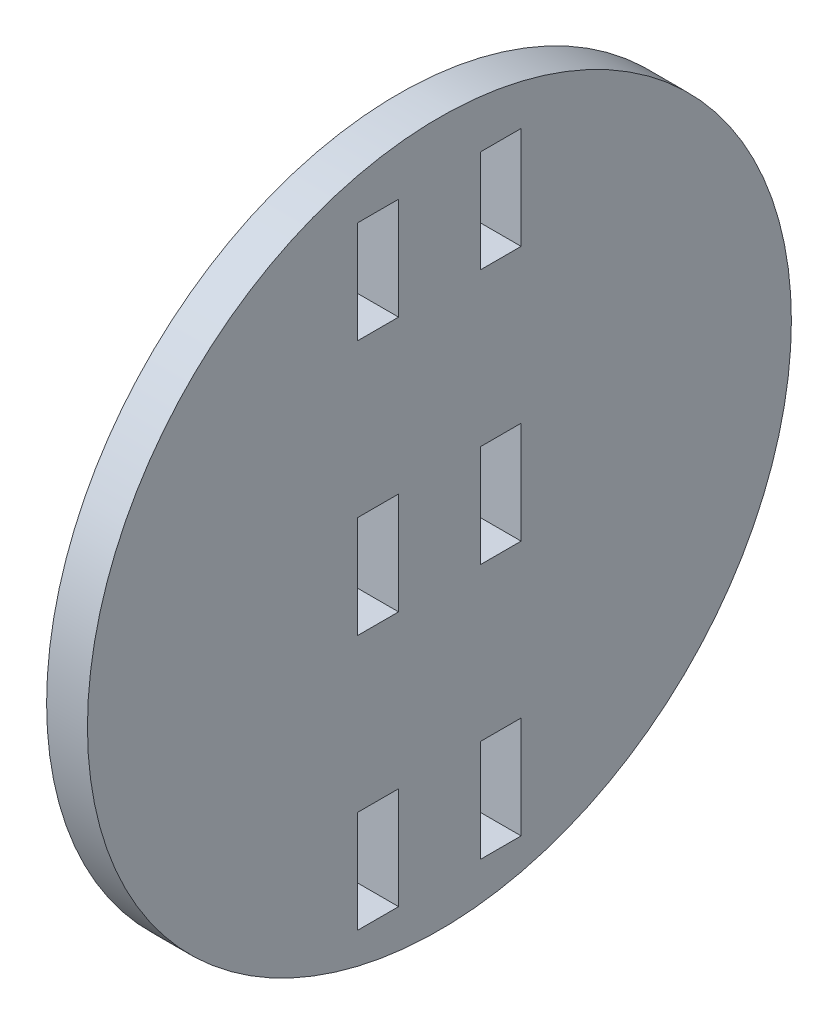
from build123d import *

# Parameters (mm, degrees)
SKETCH1_R           = 34.470588235
BOSS_EXTRUDE1_DEPTH = 2
SKETCH2_W           = 4
SKETCH2_H           = 10
CUT_EXTRUDE1_DEPTH  = 49.912604782


with BuildPart() as part:
    # Sketch1 → Boss-Extrude1 (new, symmetric)
    with BuildSketch(Plane(origin=(0, 0, 0), x_dir=(0, 0, -1), z_dir=(1, 0, 0))):
        Circle(SKETCH1_R)
    extrude(amount=BOSS_EXTRUDE1_DEPTH, both=True)

    # Sketch2 → Cut-Extrude1 (cut, through all)
    with BuildSketch(Plane(origin=(2, 0, 0), x_dir=(0, 0, -1), z_dir=(1, 0, 0))):
        with Locations((6, 24.529411765)):
            Rectangle(SKETCH2_W, SKETCH2_H)
        with Locations((6, -0.470588235)):
            Rectangle(SKETCH2_W, SKETCH2_H)
        with Locations((6, -25.470588235)):
            Rectangle(SKETCH2_W, SKETCH2_H)
    cut_extrude1 = extrude(amount=-CUT_EXTRUDE1_DEPTH, mode=Mode.SUBTRACT)

    # Mirror1: Cut-Extrude1 across plane
    add(cut_extrude1.mirror(Plane.XY), mode=Mode.SUBTRACT)


solid = part.part
